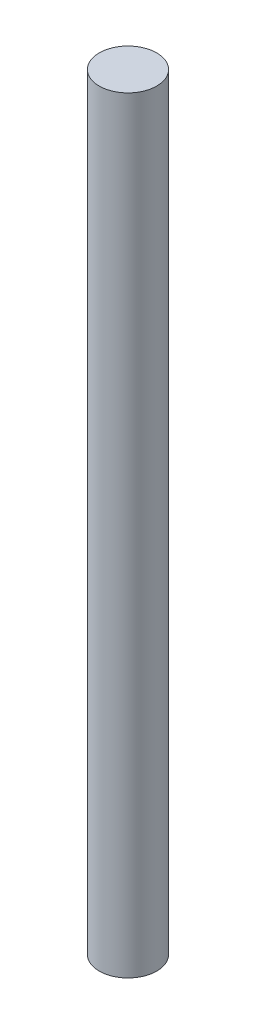
from build123d import *

# Parameters (mm, degrees)
SKIZZE1_R                       = 7.5
AUFSATZ_LINEAR_AUSTRAGEN1_DEPTH = 200


with BuildPart() as part:
    # Skizze1 → Aufsatz-Linear austragen1 (new body)
    with BuildSketch(Plane(origin=(0, 0, 0), x_dir=(1, 0, 0), z_dir=(0, 1, 0))):
        with Locations(Location((0, 0, 0), (0, 0, 270))):
            Circle(SKIZZE1_R)
    extrude(amount=AUFSATZ_LINEAR_AUSTRAGEN1_DEPTH)


solid = part.part
